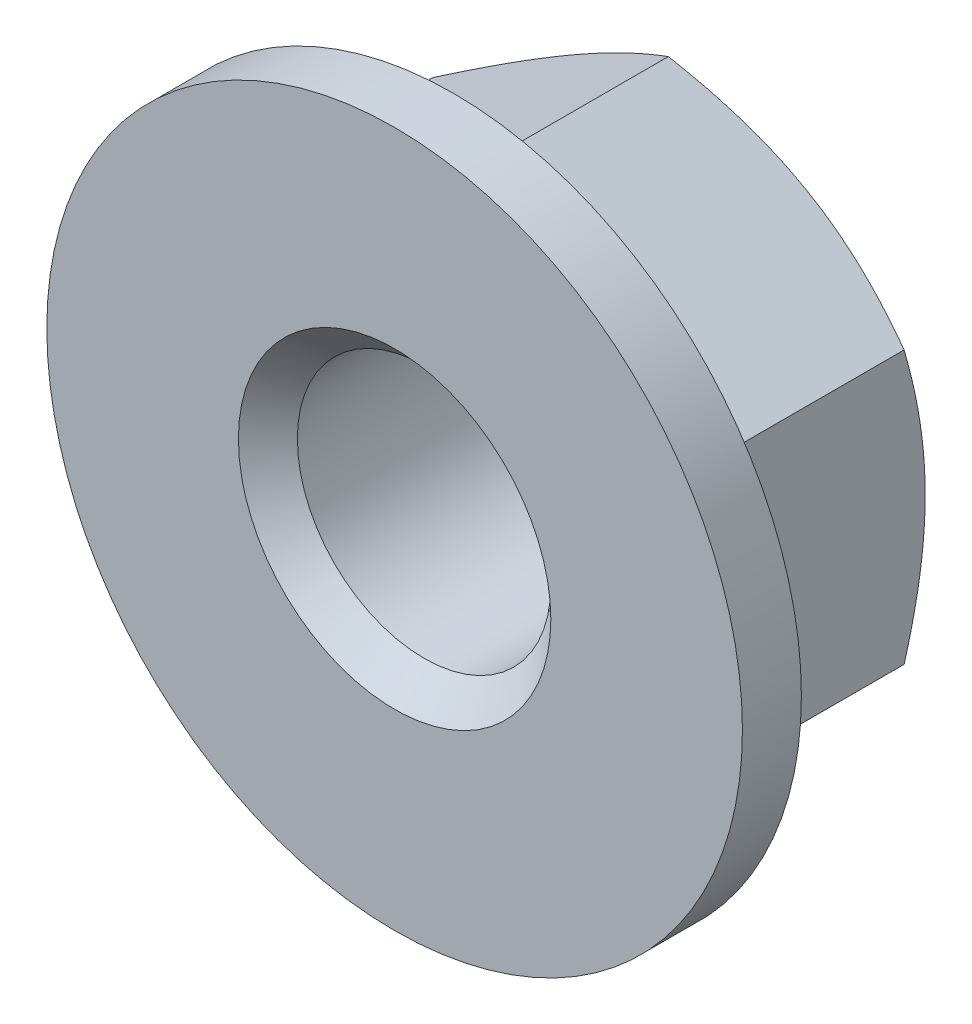
from build123d import *

# Parameters (mm, degrees)
EXTRUDE_1_DEPTH     = 4
SKETCH_3_R          = 5.9
EXTRUDE_2_DEPTH     = 1
SKETCH_4_R          = 2.15
CUT_EXTRUDE_1_DEPTH = 10.727281223
CHAMFER_1_SIZE      = 0.5


with BuildPart() as part:
    # 草图1 → 凸台-拉伸1 (new body)
    with BuildSketch(Plane.XY):
        Polygon((0, 4.618802154), (-4, 2.309401077), (-4, -2.309401077), (0, -4.618802154), (4, -2.309401077), (4, 2.309401077), align=None)
    extrude(amount=-EXTRUDE_1_DEPTH)

    # 草图2 → 切除-旋转1 (revolve, cut)
    with BuildSketch(Plane(origin=(0, 0, 0), x_dir=(0, 0, -1), z_dir=(1, 0, 0))):
        Polygon((0, 4.618802154), (0.35726559, 4.618802154), (0, 4), align=None)
        Polygon((4, 4), (3.64273441, 4.618802154), (4, 4.618802154), align=None)
    revolve(axis=Axis((0, 0, 0), (0, 0, -1)), mode=Mode.SUBTRACT)

    # 草图3 → 凸台-拉伸2 (add)
    with BuildSketch(Plane.XY):
        Circle(SKETCH_3_R)
    extrude(amount=EXTRUDE_2_DEPTH)

    # 草图4 → 切除-拉伸1 (cut, through all)
    with BuildSketch(Plane(origin=(0, 0, -4), x_dir=(-1, 0, 0), z_dir=(0, 0, -1))):
        Circle(SKETCH_4_R)
    extrude(amount=-CUT_EXTRUDE_1_DEPTH, mode=Mode.SUBTRACT)

    # 倒角1
    chamfer_1_edges = [part.edges().sort_by_distance(p)[0] for p in [
        (2.15, 0, -4),
        (2.15, 0, 1),
    ]]
    chamfer(chamfer_1_edges, length=CHAMFER_1_SIZE)


solid = part.part
